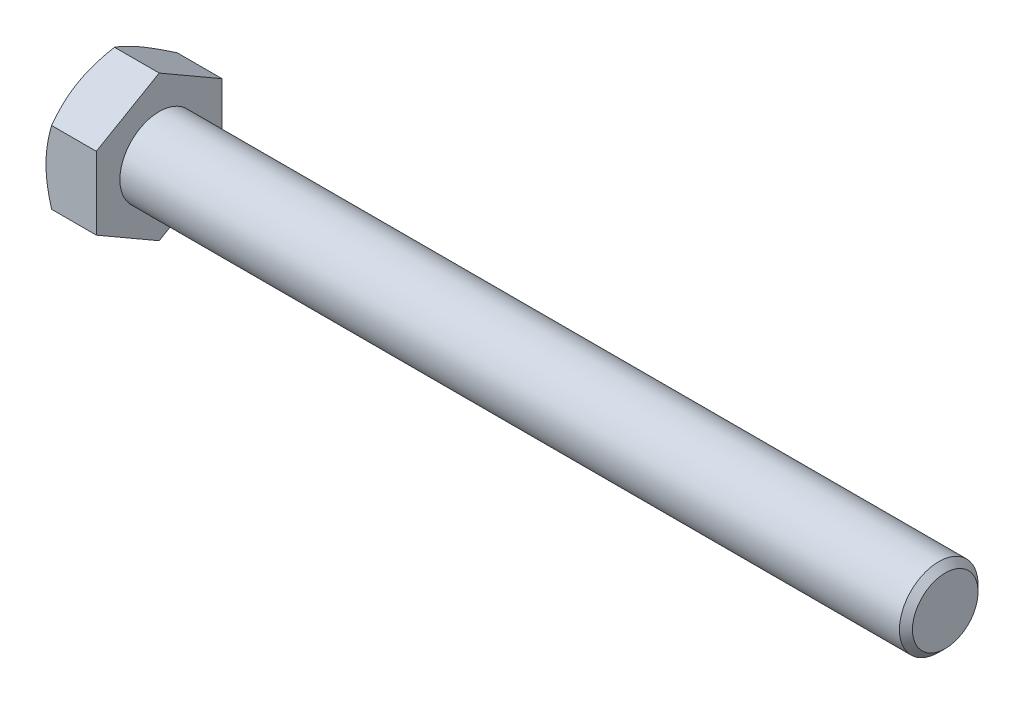
from build123d import *

# Parameters (mm, degrees)
BASEHEAD_DEPTH = 6.4


with BuildPart() as part:
    # Sketch1 → BaseHead (new body)
    with BuildSketch(Plane(origin=(0, 0, 0), x_dir=(0, 0, -1), z_dir=(1, 0, 0))):
        Polygon((8, 4.618802154), (8, -4.618802154), (0, -9.237604307), (-8, -4.618802154), (-8, 4.618802154), (0, 9.237604307), align=None)
    extrude(amount=BASEHEAD_DEPTH)

    # BodySke → BaseBody (revolve)
    with BuildSketch(Plane.XY, mode=Mode.PRIVATE) as basebody_sk:
        Polygon((0, 0), (106.4, 0), (106.4, 4.172), (105.572, 5), (0, 5), align=None)
    revolve(basebody_sk.sketch.rotate(Axis((0, 0, 0), (1, 0, 0)), 90), axis=Axis((0, 0, 0), (1, 0, 0)))

    # Sketch3 → HeadChamfer (revolve, cut)
    with BuildSketch(Plane.XY):
        Polygon((0, 8), (3.601282526, 14.237604307), (3.601282526, 19.237604307), (-10, 19.237604307), (-10, 8), align=None)
    revolve(axis=Axis((0, 0, 0), (1, 0, 0)), mode=Mode.SUBTRACT)


solid = part.part
